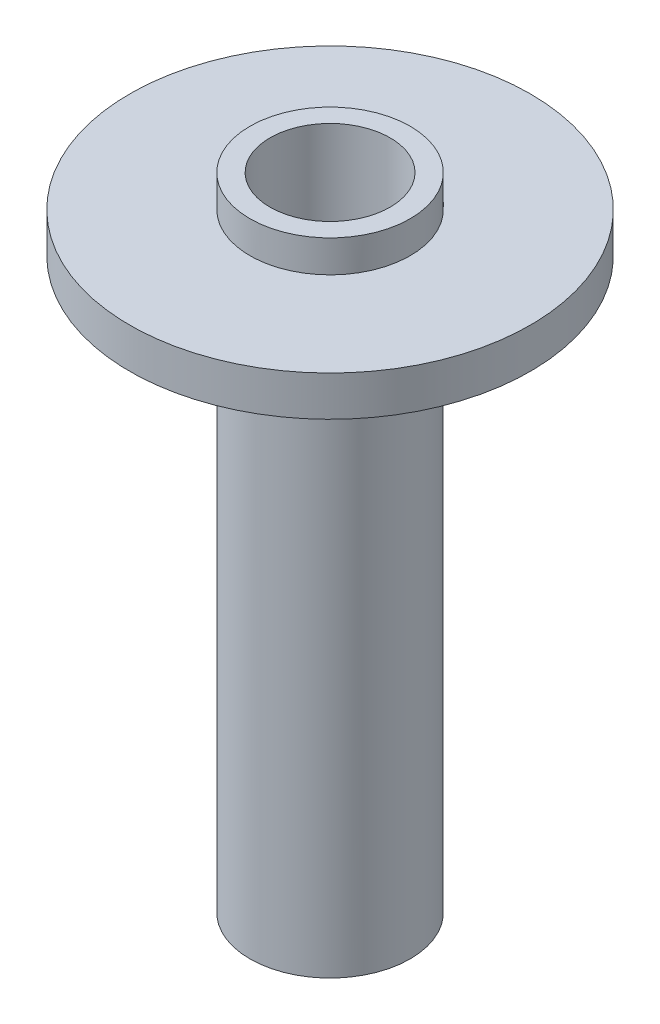
from build123d import *

# Parameters (mm, degrees)
SKETCH1_R           = 10
SKETCH1_R_2         = 7.5
BOSS_EXTRUDE1_DEPTH = 80
SKETCH2_W           = 15
SKETCH2_H           = 5


with BuildPart() as part:
    # Sketch1 → Boss-Extrude1 (new body)
    with BuildSketch(Plane(origin=(0, 0, 0), x_dir=(1, 0, 0), z_dir=(0, 1, 0))):
        with Locations(Location((0, 0, 0), (0, 0, 270))):
            Circle(SKETCH1_R)
        with Locations(Location((0, 0, 0), (0, 0, 270))):
            Circle(SKETCH1_R_2, mode=Mode.SUBTRACT)
    extrude(amount=BOSS_EXTRUDE1_DEPTH)

    # Sketch2 → Revolve1 (revolve)
    with BuildSketch(Plane(origin=(0, 0, 0), x_dir=(0, 0, -1), z_dir=(1, 0, 0))):
        with Locations((17.5, 73.5)):
            Rectangle(SKETCH2_W, SKETCH2_H)
    revolve(axis=Axis((0, 0, 0), (0, 1, 0)))


solid = part.part
